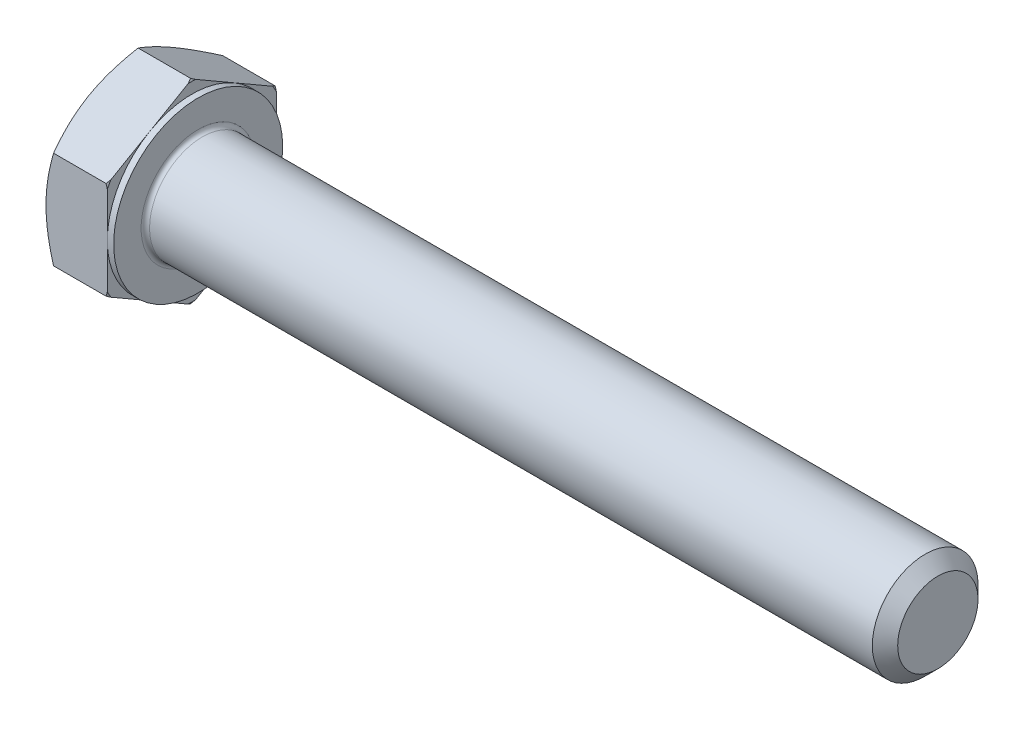
from build123d import *

# Parameters (mm, degrees)
EXTRUDE_370_DEPTH = 6.4
SKETCH_4_W        = 0.6
SKETCH_4_H        = 11.237604307
CHAMFER_2030_SIZE = 1.2
FILLET_2072_R     = 0.4


with BuildPart() as part:
    # 草图1 → Extrude 370 (new body)
    with BuildSketch(Plane(origin=(0, 0, 0), x_dir=(0, 0, -1), z_dir=(1, 0, 0))):
        Polygon((8, 4.618802154), (8, -4.618802154), (0, -9.237604307), (-8, -4.618802154), (-8, 4.618802154), (0, 9.237604307), align=None)
    extrude(amount=EXTRUDE_370_DEPTH)

    # 草图2 → 凸台-旋转1 (revolve)
    with BuildSketch(Plane.XY, mode=Mode.PRIVATE) as revolve_1_sk:
        Polygon((0, 0), (76.4, 0), (76.4, 3.701), (76.4, 5), (27.8072, 5), (0, 5), align=None)
    revolve(revolve_1_sk.sketch.rotate(Axis((0, 0, 0), (1, 0, 0)), 90), axis=Axis((0, 0, 0), (1, 0, 0)))

    # 草图3 → 切除-旋转1 (revolve, cut)
    with BuildSketch(Plane.XY):
        Polygon((0, 8), (3.601282526, 14.237604307), (3.601282526, 19.237604307), (-10, 19.237604307), (-10, 8), align=None)
    revolve(axis=Axis((0, 0, 0), (1, 0, 0)), mode=Mode.SUBTRACT)

    # 草图5 → 切除-旋转2 (revolve, cut)
    with BuildSketch(Plane.XY):
        Polygon((6.4, 8), (2.798717474, 14.237604307), (2.798717474, 19.237604307), (12.798717474, 19.237604307), (12.798717474, 8), align=None)
    revolve(axis=Axis((0, 0, 0), (1, 0, 0)), mode=Mode.SUBTRACT)

    # 草图4 → 切除-旋转3 (revolve, cut)
    with BuildSketch(Plane.XY, mode=Mode.PRIVATE) as cut_revolve_3_sk:
        with Locations((6.1, 13.618802154)):
            Rectangle(SKETCH_4_W, SKETCH_4_H)
    revolve(cut_revolve_3_sk.sketch.rotate(Axis((0, 0, 0), (1, 0, 0)), 270), axis=Axis((0, 0, 0), (1, 0, 0)), mode=Mode.SUBTRACT)

    # Chamfer 2030
    chamfer_2030_edges = [part.edges().sort_by_distance(p)[0] for p in [
        (76.4, 0, -5),
    ]]
    chamfer(chamfer_2030_edges, length=CHAMFER_2030_SIZE)

    # Fillet 2072
    fillet_2072_edges = [part.edges().sort_by_distance(p)[0] for p in [
        (6.4, 0, -5),
    ]]
    fillet(fillet_2072_edges, radius=FILLET_2072_R)


solid = part.part
